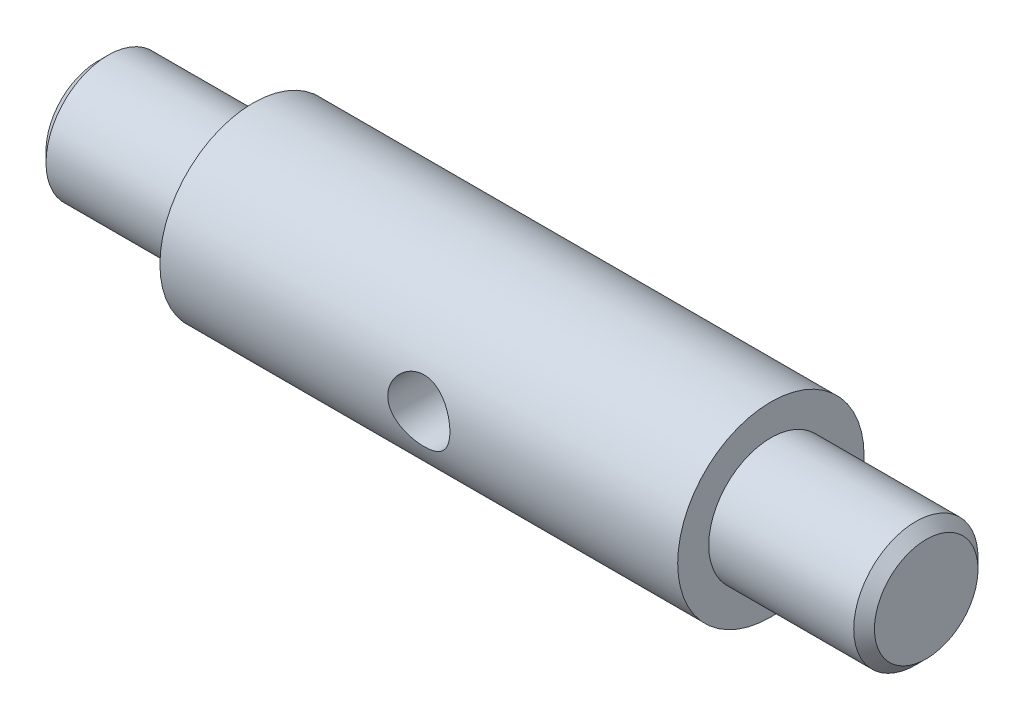
from build123d import *

# Parameters (mm, degrees)
CUT_EXTRUDE1_DEPTH           = 82.006172604
CUT_EXTRUDE1_DEPTH_BACK      = 82.006172604
SKETCH2_R                    = 3
CHAMFER1_SIZE                = 1
F_6_0_6_DIAMETER_HOLE1_D     = 6
F_6_0_6_DIAMETER_HOLE1_DEPTH = 45
F_6_0_6_DIAMETER_HOLE1_TIP   = 1.802581857


with BuildPart() as part:
    # Sketch1 → Revolve1 (revolve)
    with BuildSketch(Plane.XY, mode=Mode.PRIVATE) as revolve1_sk:
        Polygon((0, 0), (80, 0), (80, 6), (65, 6), (65, 9), (15, 9), (15, 6), (0, 6), align=None)
    revolve(revolve1_sk.sketch.rotate(Axis((0, 0, 0), (1, 0, 0)), 90), axis=Axis((0, 0, 0), (1, 0, 0)))

    # Sketch2 → Cut-Extrude1 (cut, two sides: drawn at the far end of the back side and taken through both)
    with BuildSketch(Plane.XY.offset(-CUT_EXTRUDE1_DEPTH_BACK)):
        with Locations((40, 0)):
            Circle(SKETCH2_R)
    extrude(amount=CUT_EXTRUDE1_DEPTH + CUT_EXTRUDE1_DEPTH_BACK, mode=Mode.SUBTRACT)

    # Chamfer1
    chamfer1_edges = [part.edges().sort_by_distance(p)[0] for p in [
        (0, 0, -6),
        (80, 0, -6),
    ]]
    chamfer(chamfer1_edges, length=CHAMFER1_SIZE)

    # Ø6.0 (6) Diameter Hole1
    with Locations(Plane.ZY):
        with Locations((0, 0)):
            Hole(F_6_0_6_DIAMETER_HOLE1_D / 2, depth=F_6_0_6_DIAMETER_HOLE1_DEPTH)
            with Locations((0, 0, -(F_6_0_6_DIAMETER_HOLE1_DEPTH + F_6_0_6_DIAMETER_HOLE1_TIP / 2))):  # 118° drill point
                Cone(0, F_6_0_6_DIAMETER_HOLE1_D / 2, F_6_0_6_DIAMETER_HOLE1_TIP, mode=Mode.SUBTRACT)


solid = part.part
